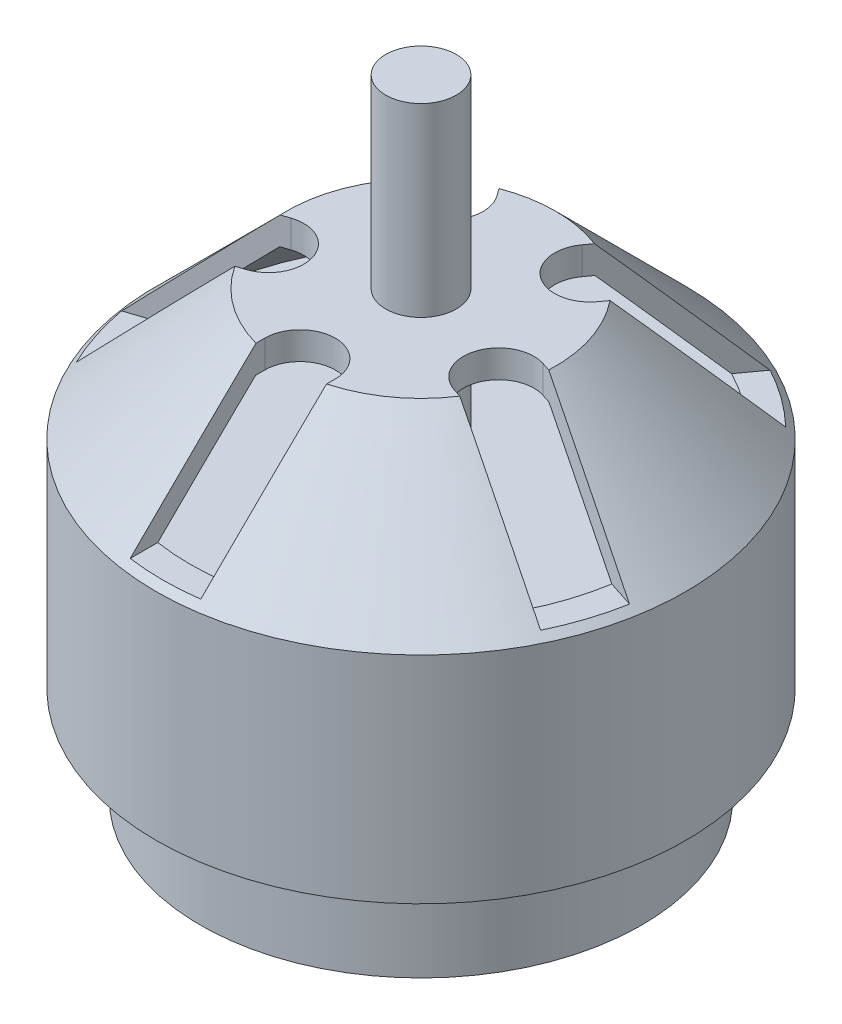
from build123d import *

# Parameters (mm, degrees)
CUT_EXTRUDE1_DEPTH = 14


with BuildPart() as part:
    # Sketch1 → Revolve1 (revolve)
    with BuildSketch(Plane.XY, mode=Mode.PRIVATE) as revolve1_sk:
        Polygon((0, 0), (0, 71), (4, 71), (4, 50), (15.241746612, 50), (30, 35.241746612), (30, 10.816092816), (25, 10.816092816), (25, 0), align=None)
        Polygon((4, 46.870301593), (15.276378104, 46.870301593), (26.904933085, 35.241746612), (4, 35.241746612), align=None, mode=Mode.SUBTRACT)
    revolve(revolve1_sk.sketch.rotate(Axis((0, 0, 0), (0, 1, 0)), 90), axis=Axis((0, 0, 0), (0, 1, 0)))

    # Sketch2 → Cut-Extrude1 (cut)
    with BuildSketch(Plane(origin=(0, 50, 0), x_dir=(1, 0, 0), z_dir=(0, 1, 0))):
        with BuildLine():
            Line((4, -13.71219958), (4, -33.089481043))
            Line((4, -33.089481043), (-4, -33.089481043))
            Line((-4, -33.089481043), (-4, -13.71219958))
            ThreePointArc((-4, -13.71219958), (0, -9.71219958), (4, -13.71219958))
        make_face()
        with BuildLine():
            Line((-30.23389859, -14.029438043), (-32.706034545, -6.420985912))
            Line((-32.706034545, -6.420985912), (-14.277144741, -0.433076635))
            ThreePointArc((-14.277144741, -0.433076635), (-9.236850698, -3.001234723), (-11.805008786, -8.041528766))
            Line((-11.805008786, -8.041528766), (-30.23389859, -14.029438043))
        make_face()
        with BuildLine():
            Line((-22.685576941, 24.41881149), (-16.213440986, 29.121093508))
            Line((-16.213440986, 29.121093508), (-4.823760712, 13.4445435))
            ThreePointArc((-4.823760712, 13.4445435), (-5.708687681, 7.857334513), (-11.295896667, 8.742261481))
            Line((-11.295896667, 8.742261481), (-22.685576941, 24.41881149))
        make_face()
        with BuildLine():
            Line((16.213440986, 29.121093508), (22.685576941, 24.41881149))
            Line((22.685576941, 24.41881149), (11.295896667, 8.742261481))
            ThreePointArc((11.295896667, 8.742261481), (5.708687681, 7.857334513), (4.823760712, 13.4445435))
            Line((4.823760712, 13.4445435), (16.213440986, 29.121093508))
        make_face()
        with BuildLine():
            Line((32.706034545, -6.420985912), (30.23389859, -14.029438043))
            Line((30.23389859, -14.029438043), (11.805008786, -8.041528766))
            ThreePointArc((11.805008786, -8.041528766), (9.236850698, -3.001234723), (14.277144741, -0.433076635))
            Line((14.277144741, -0.433076635), (32.706034545, -6.420985912))
        make_face()
    extrude(amount=-CUT_EXTRUDE1_DEPTH, mode=Mode.SUBTRACT)


solid = part.part
